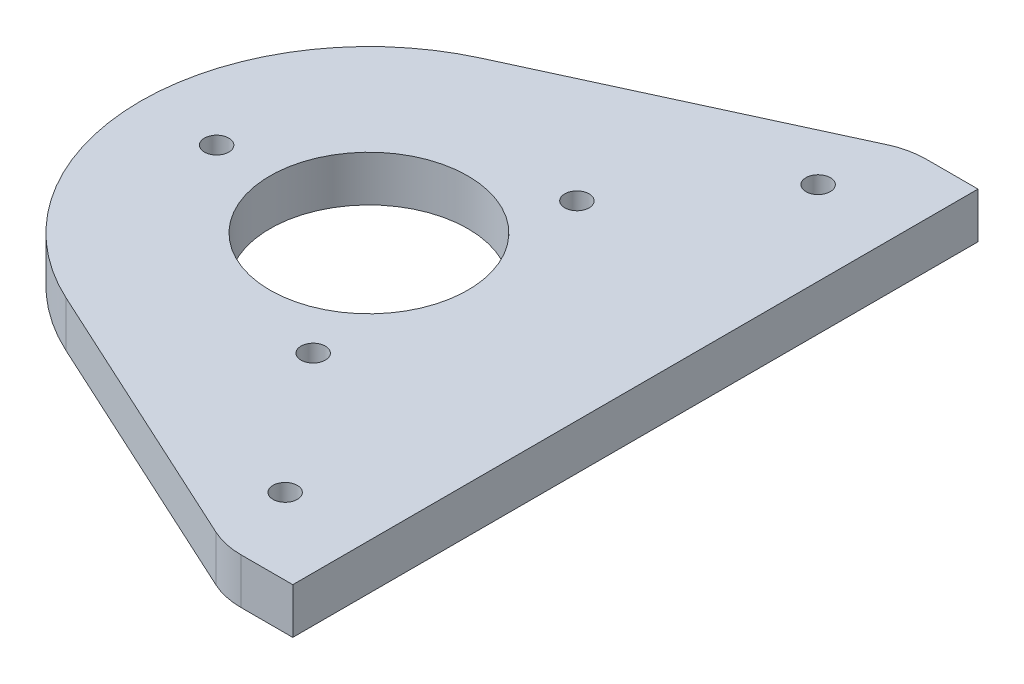
from build123d import *

# Parameters (mm, degrees)
EXTRUDE_1_DEPTH     = 6
SKETCH_2_R          = 13
SKETCH_2_R_2        = 1.6
CUT_EXTRUDE_1_DEPTH = 6
FILLET_1_R          = 10
SKETCH_3_R          = 1.6
CUT_EXTRUDE_2_DEPTH = 6


with BuildPart() as part:
    # 草图1 → 凸台-拉伸1 (new body)
    with BuildSketch(Plane(origin=(0, 0, 0), x_dir=(1, 0, 0), z_dir=(0, 1, 0))):
        with BuildLine():
            Line((23.77389059, 45), (23.77389059, -45))
            Line((23.77389059, -45), (14.77389059, -45))
            Line((14.77389059, -45), (-23.77389059, -27.249829127))
            ThreePointArc((-23.77389059, -27.249829127), (-41.22610941, 0), (-23.77389059, 27.249829127))
            Line((-23.77389059, 27.249829127), (14.77389059, 45))
            Line((14.77389059, 45), (23.77389059, 45))
        make_face()
    extrude(amount=EXTRUDE_1_DEPTH)

    # 草图2 → 切除-拉伸1 (cut)
    with BuildSketch(Plane(origin=(0, 6, 0), x_dir=(1, 0, 0), z_dir=(0, 1, 0))):
        with Locations(Location((-11.22610941, 0, 0), (0, 0, 270))):
            Circle(SKETCH_2_R)
        with Locations(Location((-31.22610941, 0, 0), (0, 0, 270))):
            Circle(SKETCH_2_R_2)
        with Locations(Location((-1.22610941, -17.320508076, 0), (0, 0, 270))):
            Circle(SKETCH_2_R_2)
        with Locations(Location((-1.22610941, 17.320508076, 0), (0, 0, 270))):
            Circle(SKETCH_2_R_2)
    extrude(amount=-CUT_EXTRUDE_1_DEPTH, mode=Mode.SUBTRACT)

    # 圆角1
    fillet_1_edges = [part.edges().sort_by_distance(p)[0] for p in [
        (14.77389059, 3, -45),
        (14.77389059, 3, 45),
    ]]
    fillet(fillet_1_edges, radius=FILLET_1_R)

    # 草图3 → 切除-拉伸2 (cut)
    with BuildSketch(Plane(origin=(0, 6, 0), x_dir=(1, 0, 0), z_dir=(0, 1, 0))):
        with Locations(Location((12.77389059, 35, 0), (0, 0, 270))):
            Circle(SKETCH_3_R)
        with Locations(Location((12.77389059, -35, 0), (0, 0, 270))):
            Circle(SKETCH_3_R)
    extrude(amount=-CUT_EXTRUDE_2_DEPTH, mode=Mode.SUBTRACT)


solid = part.part
